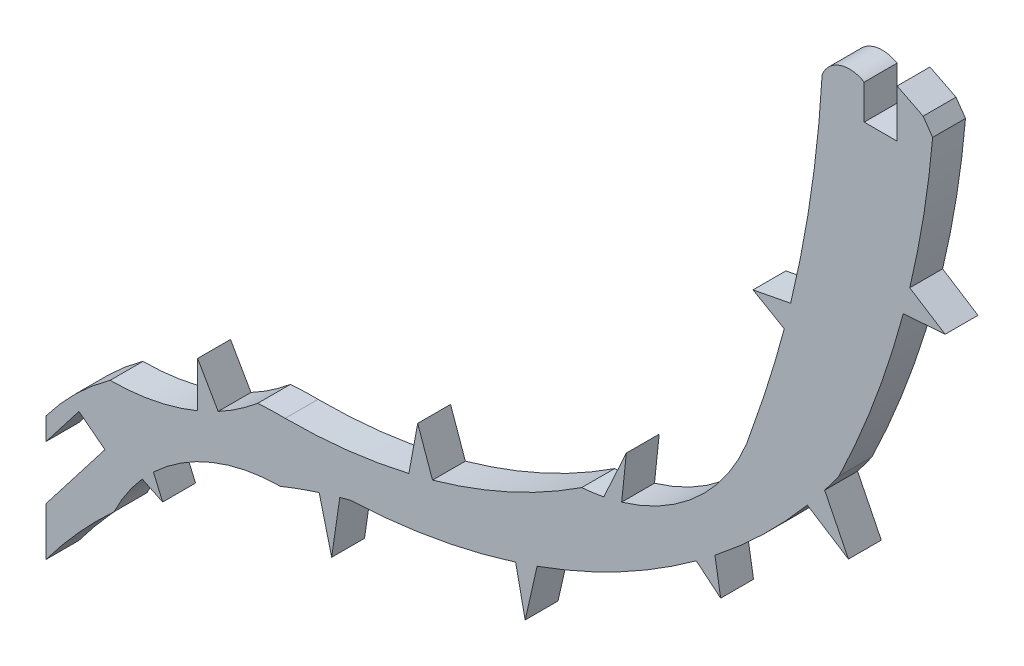
from build123d import *

# Parameters (mm, degrees)
BOSS_EXTRUDE1_DEPTH = 1.524


with BuildPart() as part:
    # Sketch1 → Boss-Extrude1 (new body)
    with BuildSketch(Plane.XY):
        with BuildLine():
            Line((0, 36.766680051), (1.524, 36.766680051))
            Line((1.524, 36.766680051), (1.524, 38.982585825))
            Line((1.524, 38.982585825), (2.733148625, 38.375210755))
            Line((2.733148625, 38.375210755), (3.173163666, 37.740395602))
            ThreePointArc((3.173163666, 37.740395602), (2.76380149, 34.435260273), (2.111575724, 31.169360935))
            Line((2.111575724, 31.169360935), (3.752142818, 30.122391454))
            Line((3.752142818, 30.122391454), (1.811466825, 29.982342047))
            ThreePointArc((1.811466825, 29.982342047), (0.512131502, 25.907377193), (-1.167502988, 21.973875087))
            ThreePointArc((-1.167502988, 21.973875087), (-1.496079249, 21.518994961), (-1.833336721, 21.070513426))
            Line((-1.833336721, 21.070513426), (-0.732526116, 18.85197433))
            Line((-0.732526116, 18.85197433), (-2.63805659, 20.068036908))
            ThreePointArc((-2.63805659, 20.068036908), (-4.673990558, 17.880915718), (-6.922800397, 15.913333311))
            Line((-6.922800397, 15.913333311), (-6.657550745, 14.318385487))
            Line((-6.657550745, 14.318385487), (-7.787922662, 15.257015862))
            ThreePointArc((-7.787922662, 15.257015862), (-11.338183777, 13.037842353), (-15.16934542, 11.349267359))
            Line((-15.16934542, 11.349267359), (-15.723402455, 8.912532591))
            Line((-15.723402455, 8.912532591), (-16.164329399, 11.013577704))
            ThreePointArc((-16.164329399, 11.013577704), (-19.953116728, 10.084187136), (-23.831985363, 9.668189099))
            ThreePointArc((-23.831985363, 9.668189099), (-24.076075542, 9.604568952), (-24.319524306, 9.538536852))
            Line((-24.319524306, 9.538536852), (-24.695691572, 6.942894819))
            Line((-24.695691572, 6.942894819), (-25.27612991, 9.253711636))
            ThreePointArc((-25.27612991, 9.253711636), (-26.183331796, 8.945243362), (-27.078300937, 8.602901171))
            ThreePointArc((-27.078300937, 8.602901171), (-30.246868295, 7.97926726), (-32.962548086, 6.231748554))
            Line((-32.962548086, 6.231748554), (-32.532162923, 5.243855929))
            Line((-32.532162923, 5.243855929), (-33.480739201, 5.694007752))
            ThreePointArc((-33.480739201, 5.694007752), (-34.200835329, 4.756022574), (-34.785563978, 3.728186482))
            ThreePointArc((-34.785563978, 3.728186482), (-36.445037111, 2.053220727), (-37.942668533, 0.232105276))
            Line((-37.942668533, 0.232105276), (-37.938700484, 2.479305956))
            Line((-37.938700484, 2.479305956), (-35.209054914, 6.010902474))
            Line((-35.209054914, 6.010902474), (-36.41486015, 6.942894819))
            Line((-36.41486015, 6.942894819), (-37.934290003, 4.977067008))
            Line((-37.934290003, 4.977067008), (-37.932464483, 6.010902474))
            ThreePointArc((-37.932464483, 6.010902474), (-36.563778761, 7.575593862), (-34.971875943, 8.912532591))
            ThreePointArc((-34.971875943, 8.912532591), (-32.901550016, 9.116540541), (-30.910632492, 9.719960876))
            Line((-30.910632492, 9.719960876), (-30.910632492, 11.8237405))
            Line((-30.910632492, 11.8237405), (-29.95978759, 10.169722089))
            ThreePointArc((-29.95978759, 10.169722089), (-29.013670421, 10.741179379), (-28.13202331, 11.407812338))
            ThreePointArc((-28.13202331, 11.407812338), (-27.492889702, 11.44249827), (-26.85283117, 11.446965831))
            ThreePointArc((-26.85283117, 11.446965831), (-23.965434713, 11.605929088), (-21.115990345, 12.098873725))
            Line((-21.115990345, 12.098873725), (-20.706404595, 14.318385487))
            Line((-20.706404595, 14.318385487), (-20.019464899, 12.381448288))
            ThreePointArc((-20.019464899, 12.381448288), (-16.437841998, 13.695848714), (-13.099310966, 15.542435195))
            ThreePointArc((-13.099310966, 15.542435195), (-12.585951474, 15.59640554), (-12.076536587, 15.679755638))
            Line((-12.076536587, 15.679755638), (-11.031123121, 17.962204557))
            Line((-11.031123121, 17.962204557), (-11.249347571, 15.880665501))
            ThreePointArc((-11.249347571, 15.880665501), (-7.425610197, 18.149727188), (-5.157240456, 21.973875087))
            ThreePointArc((-5.157240456, 21.973875087), (-4.381951062, 24.278807565), (-3.708542129, 26.615537712))
            Line((-3.708542129, 26.615537712), (-5.157240456, 27.453082135))
            Line((-5.157240456, 27.453082135), (-3.412165634, 27.787336527))
            ThreePointArc((-3.412165634, 27.787336527), (-2.457151359, 32.712229886), (-1.951475295, 37.703313794))
            ThreePointArc((-1.951475295, 37.703313794), (-1.128983902, 38.484354747), (0, 38.375210755))
            Line((0, 38.375210755), (0, 36.766680051))
        make_face()
    extrude(amount=BOSS_EXTRUDE1_DEPTH)


solid = part.part
